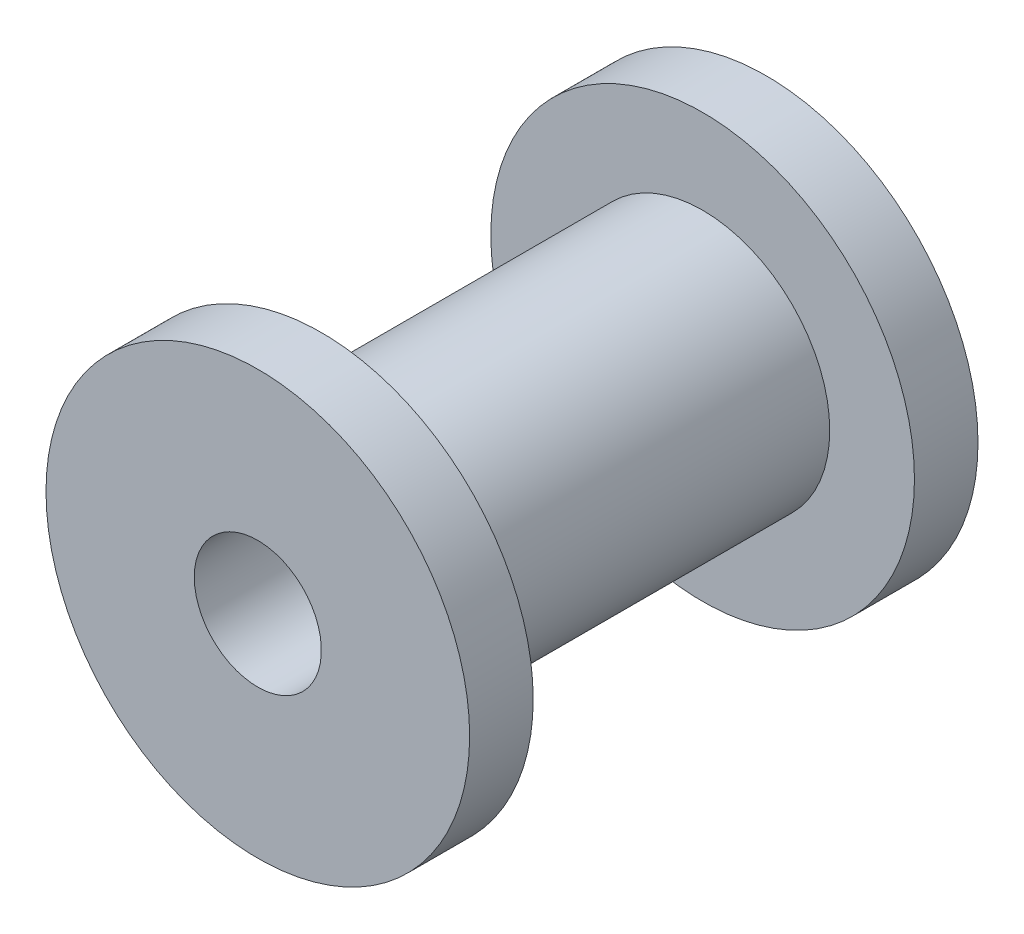
from build123d import *

# Parameters (mm, degrees)
EXTRUDE_1_DEPTH      = 4.5
EXTRUDE_1_DEPTH_BACK = 4.5
SKETCH_1_R           = 3
SKETCH_2_R           = 5
EXTRUDE_2_DEPTH      = 1.5
EXTRUDE_START        = 1.5
SKETCH_3_R           = 5
EXTRUDE_3_DEPTH      = 1.5
SKETCH_4_R           = 1.5
CUT_EXTRUDE_1_DEPTH  = 14.928388277


with BuildPart() as part:
    # 草图1 → 凸台-拉伸1 (new, two sides: drawn at the far end of the back side and taken through both)
    with BuildSketch(Plane.XY.offset(-EXTRUDE_1_DEPTH_BACK)):
        Circle(SKETCH_1_R)
    extrude(amount=EXTRUDE_1_DEPTH + EXTRUDE_1_DEPTH_BACK)

    # 草图2 → 凸台-拉伸2 (add)
    with BuildSketch(Plane.XY.offset(4.5)):
        Circle(SKETCH_2_R)
    extrude(amount=EXTRUDE_2_DEPTH)

    # 草图3 → 凸台-拉伸3 (add)
    with BuildSketch(Plane(origin=(0, 0, -4.5), x_dir=(-1, 0, 0), z_dir=(0, 0, -1)).offset(EXTRUDE_START)):
        Circle(SKETCH_3_R)
    extrude(amount=-EXTRUDE_3_DEPTH)

    # 草图4 → 切除-拉伸1 (cut, through all)
    with BuildSketch(Plane(origin=(0, 0, -6), x_dir=(-1, 0, 0), z_dir=(0, 0, -1))):
        Circle(SKETCH_4_R)
    extrude(amount=-CUT_EXTRUDE_1_DEPTH, mode=Mode.SUBTRACT)


solid = part.part
